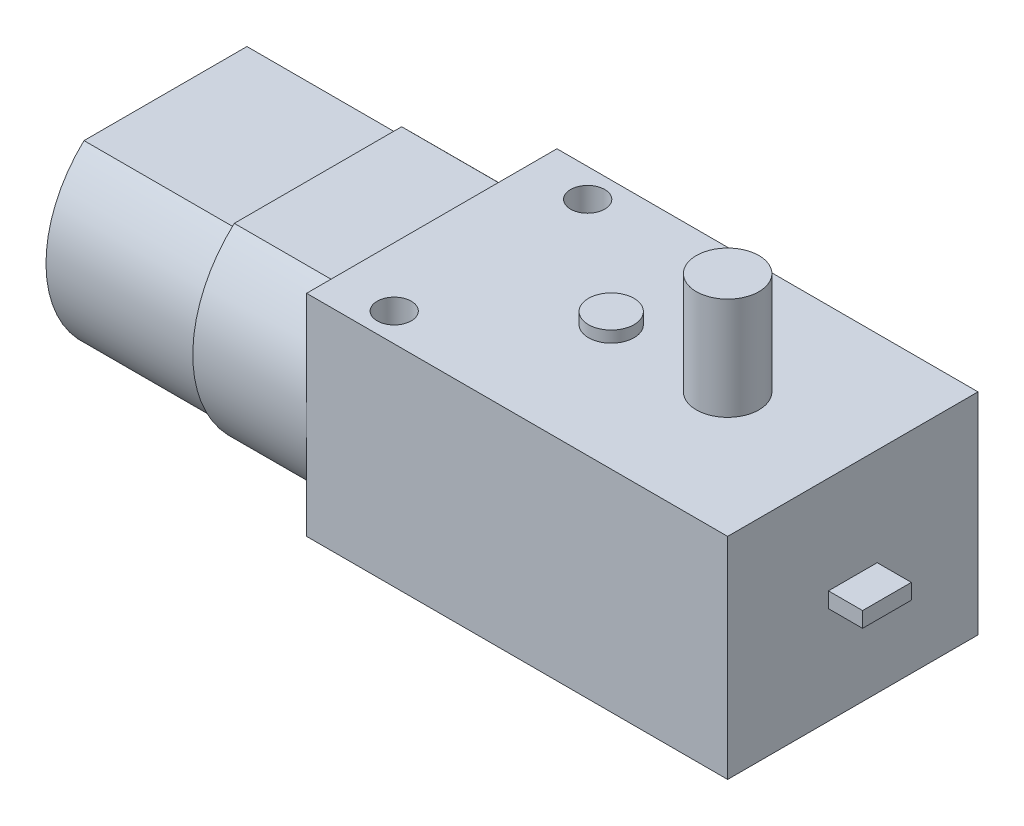
from build123d import *

# Parameters (mm, degrees)
SKETCH_1_W          = 37
SKETCH_1_H          = 18.5
EXTRUDE_1_DEPTH     = 11
EXTRUDE_2_DEPTH     = 10
EXTRUDE_3_DEPTH     = 13.4
SKETCH_4_W          = 4.285372044
SKETCH_4_H          = 1.354621624
EXTRUDE_4_DEPTH     = 3
SKETCH_5_R          = 2
EXTRUDE_5_DEPTH     = 1
SKETCH_6_R          = 1.5
CUT_EXTRUDE_1_DEPTH = 20
SKETCH_8_R          = 2.75
EXTRUDE_6_DEPTH     = 9


with BuildPart() as part:
    # 스케치1 → 보스-돌출1 (new, symmetric)
    with BuildSketch(Plane.XY):
        Rectangle(SKETCH_1_W, SKETCH_1_H)
    extrude(amount=EXTRUDE_1_DEPTH, both=True)

    # 스케치2 → 보스-돌출2 (add)
    with BuildSketch(Plane.ZY.offset(18.5)):
        with BuildLine():
            Line((-6.225208394, -9.5), (6.225208394, -9.5))
            ThreePointArc((6.225208394, -9.5), (10.976552571, -1.148838505), (7.353316024, 7.75))
            Line((7.353316024, 7.75), (-7.353316024, 7.75))
            ThreePointArc((-7.353316024, 7.75), (-10.976552571, -1.148838505), (-6.225208394, -9.5))
        make_face()
    extrude(amount=EXTRUDE_2_DEPTH)

    # 스케치3 → 보스-돌출3 (add)
    with BuildSketch(Plane.ZY.offset(28.5)):
        with BuildLine():
            Line((-6.068131559, -9), (6.068131559, -9))
            ThreePointArc((6.068131559, -9), (10.476417681, -1.134328554), (7.159068059, 7.25))
            Line((7.159068059, 7.25), (-7.159068059, 7.25))
            ThreePointArc((-7.159068059, 7.25), (-10.476417681, -1.134328554), (-6.068131559, -9))
        make_face()
    extrude(amount=EXTRUDE_3_DEPTH)

    # 스케치4 → 보스-돌출4 (add)
    with BuildSketch(Plane(origin=(18.5, 0, 0), x_dir=(0, 0, -1), z_dir=(1, 0, 0))):
        Rectangle(SKETCH_4_W, SKETCH_4_H)
    extrude(amount=EXTRUDE_4_DEPTH)

    # 스케치5 → 보스-돌출5 (add)
    with BuildSketch(Plane(origin=(0, 9.25, 0), x_dir=(1, 0, 0), z_dir=(0, 1, 0))):
        with Locations((-2.729015684, 0)):
            Circle(SKETCH_5_R)
    extrude(amount=EXTRUDE_5_DEPTH)

    # 스케치6 → 컷-돌출1 (cut)
    with BuildSketch(Plane(origin=(0, 9.25, 0), x_dir=(1, 0, 0), z_dir=(0, 1, 0))):
        with Locations(Location((-13.3, 8.5, 0), (0, 0, 180))):
            Circle(SKETCH_6_R)
        with Locations(Location((-13.3, -8.5, 0), (0, 0, 180))):
            Circle(SKETCH_6_R)
    extrude(amount=-CUT_EXTRUDE_1_DEPTH, mode=Mode.SUBTRACT)

    # 스케치8 → 보스-돌출6 (add)
    with BuildSketch(Plane(origin=(0, 9.25, 0), x_dir=(1, 0, 0), z_dir=(0, 1, 0))):
        with Locations((7.5, 0)):
            Circle(SKETCH_8_R)
    extrude(amount=EXTRUDE_6_DEPTH)


solid = part.part
